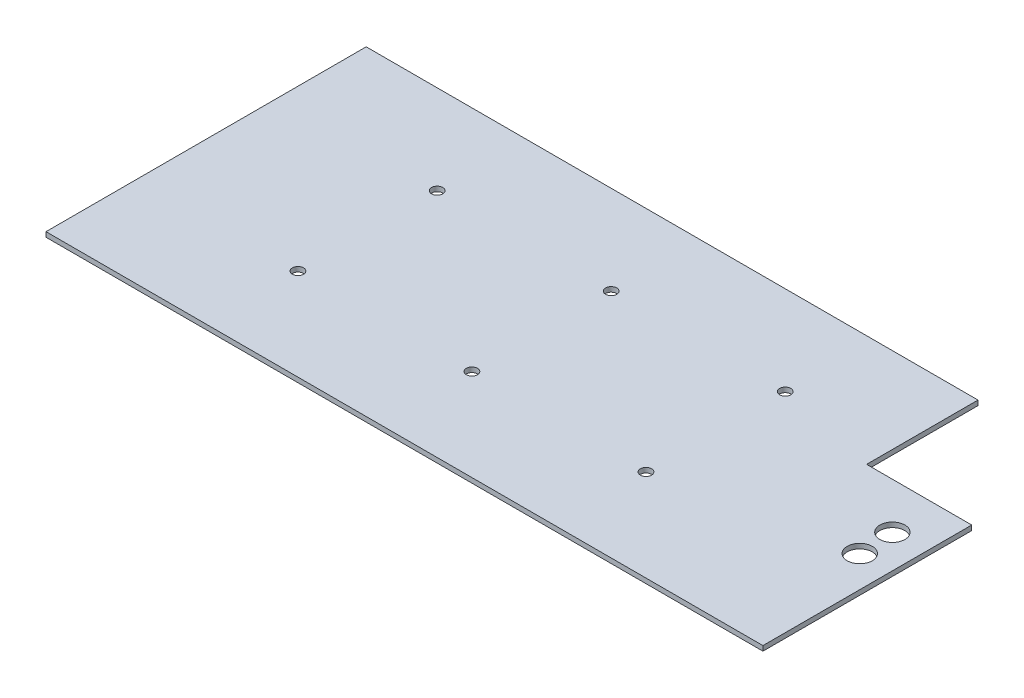
from build123d import *

# Parameters (mm, degrees)
BOSS_EXTRUDE1_DEPTH     = 3.5
CUT_EXTRUDE1_DEPTH      = 565.036567963
CUT_EXTRUDE1_DEPTH_BACK = 565.036567963
SKETCH2_R               = 4
SKETCH2_R_2             = 9


with BuildPart() as part:
    # Sketch1 → Boss-Extrude1 (new body)
    with BuildSketch(Plane(origin=(0, 0, 0), x_dir=(1, 0, 0), z_dir=(0, 1, 0))):
        Polygon((0, 0), (0, 150), (0, 230), (20, 230), (439.5, 230), (439.5, 150), (515, 150), (515, 0), align=None)
    extrude(amount=BOSS_EXTRUDE1_DEPTH)

    # Sketch2 → Cut-Extrude1 (cut, two sides: drawn at the far end of the back side and taken through both)
    with BuildSketch(Plane(origin=(0, 3.5, 0), x_dir=(1, 0, 0), z_dir=(0, 1, 0)).offset(-CUT_EXTRUDE1_DEPTH_BACK)):
        with Locations((115, 166)):
            Circle(SKETCH2_R)
        with Locations((240, 166)):
            Circle(SKETCH2_R)
        with Locations((365, 166)):
            Circle(SKETCH2_R)
        with Locations((365, 66)):
            Circle(SKETCH2_R)
        with Locations((240, 66)):
            Circle(SKETCH2_R)
        with Locations((115, 66)):
            Circle(SKETCH2_R)
        with Locations((492.517503026, 92.046098811)):
            Circle(SKETCH2_R_2)
        with Locations((491, 117)):
            Circle(SKETCH2_R_2)
    extrude(amount=CUT_EXTRUDE1_DEPTH + CUT_EXTRUDE1_DEPTH_BACK, mode=Mode.SUBTRACT)


solid = part.part
